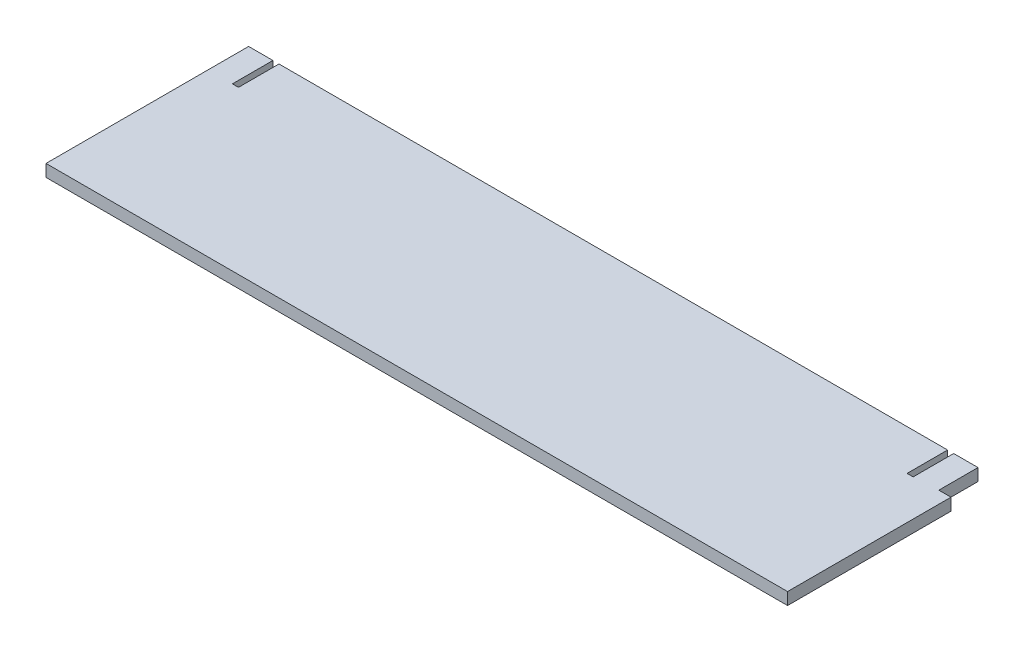
from build123d import *

# Parameters (mm, degrees)
BOSS_EXTRUDE1_DEPTH = 1.5
SKETCH2_W           = 3
SKETCH2_H           = 40.331406252
BOSS_EXTRUDE2_DEPTH = 1.5


with BuildPart() as part:
    # Sketch1 → Boss-Extrude1 (new, symmetric)
    with BuildSketch(Plane(origin=(0, 0, 0), x_dir=(1, 0, 0), z_dir=(0, 1, 0))):
        Polygon((-84, 25), (-84, 15), (-82.5, 15), (-82.5, 25), (82.5, 25), (82.5, 15), (84, 15), (84, 25), (90, 25), (90, -25), (-90, -25), (-90, 25), align=None)
    extrude(amount=BOSS_EXTRUDE1_DEPTH, both=True)

    # Sketch2 → Boss-Extrude2 (add, symmetric)
    with BuildSketch(Plane(origin=(0, 0, 0), x_dir=(1, 0, 0), z_dir=(0, 1, 0))):
        with Locations((91.5, -4.834296874)):
            Rectangle(SKETCH2_W, SKETCH2_H)
    extrude(amount=BOSS_EXTRUDE2_DEPTH, both=True)


solid = part.part
